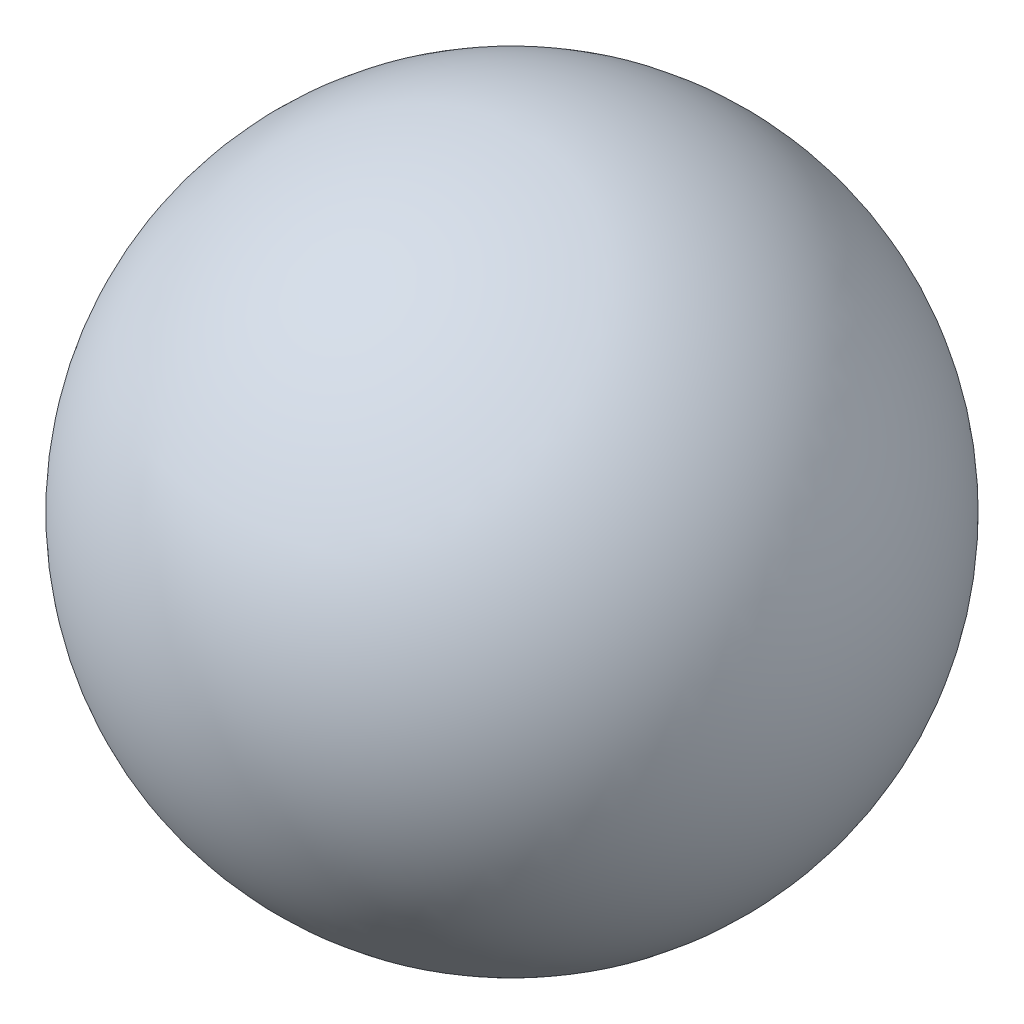
from build123d import *


with BuildPart() as part:
    # Sketch1 → Revolve-Thin1 (revolve)
    with BuildSketch(Plane.XY):
        with BuildLine():
            ThreePointArc((0, -38.1), (38.1, 0), (0, 38.1))
            Line((0, 38.1), (0, 63.5))
            ThreePointArc((0, 63.5), (63.5, 0), (0, -63.5))
            Line((0, -63.5), (0, -38.1))
        make_face()
    revolve(axis=Axis((0, -38.1, 0), (0, 1, 0)))


solid = part.part
